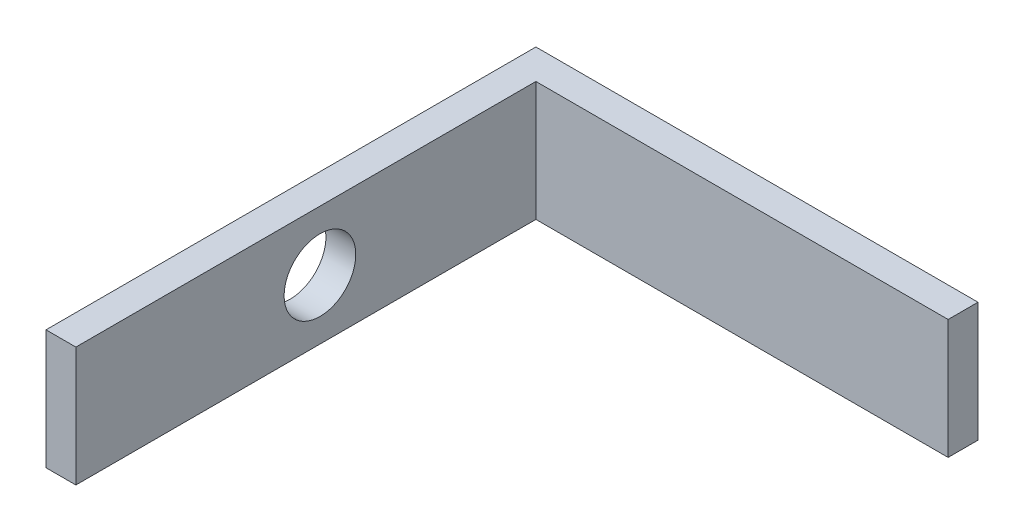
from build123d import *

# Parameters (mm, degrees)
BOSS_EXTRUDE1_DEPTH = 7.9375
SKETCH3_R           = 4.7625
CUT_EXTRUDE1_DEPTH  = 3.96875


with BuildPart() as part:
    # Sketch1 → Boss-Extrude1 (new, symmetric)
    with BuildSketch(Plane(origin=(0, 0, 0), x_dir=(1, 0, 0), z_dir=(0, 1, 0))):
        Polygon((-2.757708096, -19.86108723), (1.211041904, -19.86108723), (1.211041904, 41.25766277), (55.979791904, 41.25766277), (55.979791904, 45.22641277), (6.27967861, 45.22641277), (-2.757708096, 45.22641277), align=None)
    extrude(amount=BOSS_EXTRUDE1_DEPTH, both=True)

    # Sketch3 → Cut-Extrude1 (cut)
    with BuildSketch(Plane.ZY.offset(2.757708096)):
        with Locations((-12.566559842, 0)):
            Circle(SKETCH3_R)
    extrude(amount=-CUT_EXTRUDE1_DEPTH, mode=Mode.SUBTRACT)


solid = part.part
